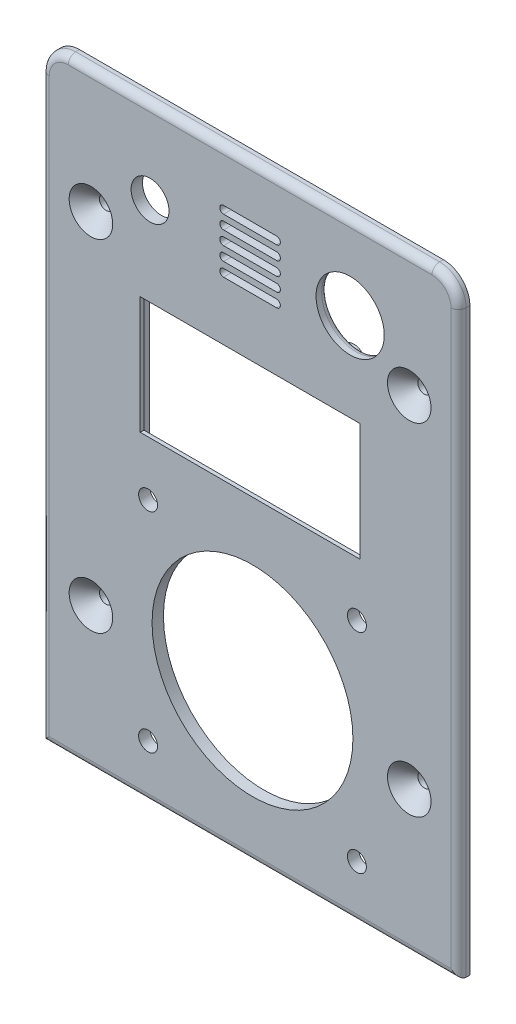
from build123d import *

# Parameters (mm, degrees)
BOSS_EXTRUDE1_DEPTH     = 3
FILLET1_R               = 2
SKETCH3_W               = 96
SKETCH3_H               = 152.5
BOSS_EXTRUDE2_DEPTH     = 3.9
CUT_EXTRUDE1_REACH      = 196.287
SKETCH4_R               = 1.75
CHAMFER1_SIZE           = 4
SKETCH5_R               = 5
SKETCH5_R_2             = 9
CUT_EXTRUDE2_DEPTH      = 195.204042265
FILLET2_R               = 1.5
SKETCH7_W               = 20
SKETCH7_H               = 20
SKETCH7_W_2             = 18
SKETCH7_H_2             = 18
BOSS_EXTRUDE3_DEPTH     = 3.9
CUT_EXTRUDE3_DEPTH      = 195.204042265
CROQUIS1_R              = 3
CROQUIS1_R_2            = 1.25
SALIENTE_EXTRUIR1_DEPTH = 5
CROQUIS2_R              = 3
CROQUIS2_R_2            = 1.25
CROQUIS2_W              = 22
CROQUIS2_H              = 3
SALIENTE_EXTRUIR2_DEPTH = 5.5
CORTAR_EXTRUIR1_REACH   = 196.243
CROQUIS3_R              = 26.5
CORTAR_EXTRUIR2_REACH   = 196.243
CROQUIS4_R              = 2.5
CROQUIS5_W              = 59
CROQUIS5_H              = 40
CORTAR_EXTRUIR3_DEPTH   = 2
CROQUIS6_W              = 58
CROQUIS6_H              = 31
CORTAR_EXTRUIR4_DEPTH   = 2


with BuildPart() as part:
    # Sketch1 → Boss-Extrude1 (new body)
    with BuildSketch(Plane.XY):
        with BuildLine():
            Line((0, 0), (110, 0))
            Line((110, 0), (110, 153))
            ThreePointArc((110, 153), (107.949747468, 157.949747468), (103, 160))
            Line((103, 160), (7, 160))
            ThreePointArc((7, 160), (2.050252532, 157.949747468), (0, 153))
            Line((0, 153), (0, 0))
        make_face()
    extrude(amount=BOSS_EXTRUDE1_DEPTH)

    # Fillet1
    fillet1_edges = [part.edges().sort_by_distance(p)[0] for p in [
        (110, 76.5, 3),
        (107.949747468, 157.949747468, 3),
        (55, 160, 3),
        (2.050252532, 157.949747468, 3),
        (0, 76.5, 3),
        (55, 0, 3),
    ]]
    fillet(fillet1_edges, radius=FILLET1_R)

    # Sketch3 → Boss-Extrude2 (add)
    with BuildSketch(Plane(origin=(0, 0, 0), x_dir=(-1, 0, 0), z_dir=(0, 0, -1))):
        with Locations((-55, 76.25)):
            Rectangle(SKETCH3_W, SKETCH3_H)
        with BuildLine():
            Line((-101.4, 1.6), (-101.4, 33.5))
            Line((-101.4, 33.5), (-97, 33.5))
            ThreePointArc((-97, 33.5), (-93, 37.5), (-97, 41.5))
            Line((-97, 41.5), (-101.4, 41.5))
            Line((-101.4, 41.5), (-101.4, 123.5))
            Line((-101.4, 123.5), (-97, 123.5))
            ThreePointArc((-97, 123.5), (-93, 127.5), (-97, 131.5))
            Line((-97, 131.5), (-101.4, 131.5))
            Line((-101.4, 131.5), (-101.4, 150.9))
            Line((-101.4, 150.9), (-8.6, 150.9))
            Line((-8.6, 150.9), (-8.6, 131.5))
            Line((-8.6, 131.5), (-13, 131.5))
            ThreePointArc((-13, 131.5), (-17, 127.5), (-13, 123.5))
            Line((-13, 123.5), (-8.6, 123.5))
            Line((-8.6, 123.5), (-8.6, 41.5))
            Line((-8.6, 41.5), (-13, 41.5))
            ThreePointArc((-13, 41.5), (-17, 37.5), (-13, 33.5))
            Line((-13, 33.5), (-8.6, 33.5))
            Line((-8.6, 33.5), (-8.6, 1.6))
            Line((-8.6, 1.6), (-101.4, 1.6))
        make_face(mode=Mode.SUBTRACT)
    extrude(amount=BOSS_EXTRUDE2_DEPTH)

    # Sketch4 → Cut-Extrude1 (cut, up to next)
    with BuildSketch(Plane(origin=(0, 0, -3.9), x_dir=(-1, 0, 0), z_dir=(0, 0, -1)), mode=Mode.PRIVATE) as cut_extrude1_sk1:
        with Locations((-97, 127.5)):
            Circle(SKETCH4_R)
    cut_extrude1_tool1 = extrude(cut_extrude1_sk1.sketch, amount=-CUT_EXTRUDE1_REACH, mode=Mode.PRIVATE) & part.part
    # Sketch4 → Cut-Extrude1 (cut, up to next)
    with BuildSketch(Plane(origin=(0, 0, -3.9), x_dir=(-1, 0, 0), z_dir=(0, 0, -1)), mode=Mode.PRIVATE) as cut_extrude1_sk2:
        with Locations((-13, 127.5)):
            Circle(SKETCH4_R)
    cut_extrude1_tool2 = extrude(cut_extrude1_sk2.sketch, amount=-CUT_EXTRUDE1_REACH, mode=Mode.PRIVATE) & part.part
    # Sketch4 → Cut-Extrude1 (cut, up to next)
    with BuildSketch(Plane(origin=(0, 0, -3.9), x_dir=(-1, 0, 0), z_dir=(0, 0, -1)), mode=Mode.PRIVATE) as cut_extrude1_sk3:
        with Locations((-13, 37.5)):
            Circle(SKETCH4_R)
    cut_extrude1_tool3 = extrude(cut_extrude1_sk3.sketch, amount=-CUT_EXTRUDE1_REACH, mode=Mode.PRIVATE) & part.part
    # Sketch4 → Cut-Extrude1 (cut, up to next)
    with BuildSketch(Plane(origin=(0, 0, -3.9), x_dir=(-1, 0, 0), z_dir=(0, 0, -1)), mode=Mode.PRIVATE) as cut_extrude1_sk4:
        with Locations((-97, 37.5)):
            Circle(SKETCH4_R)
    cut_extrude1_tool4 = extrude(cut_extrude1_sk4.sketch, amount=-CUT_EXTRUDE1_REACH, mode=Mode.PRIVATE) & part.part
    add(cut_extrude1_tool1.solids().sort_by_distance((97, 127.5, -3.9))[0], mode=Mode.SUBTRACT)
    add(cut_extrude1_tool2.solids().sort_by_distance((13, 127.5, -3.9))[0], mode=Mode.SUBTRACT)
    add(cut_extrude1_tool3.solids().sort_by_distance((13, 37.5, -3.9))[0], mode=Mode.SUBTRACT)
    add(cut_extrude1_tool4.solids().sort_by_distance((97, 37.5, -3.9))[0], mode=Mode.SUBTRACT)

    # Chamfer1
    chamfer1_edges = [part.edges().sort_by_distance(p)[0] for p in [
        (98.75, 37.5, 3),
        (14.75, 37.5, 3),
        (14.75, 127.5, 3),
        (98.75, 127.5, 3),
    ]]
    chamfer(chamfer1_edges, length=CHAMFER1_SIZE)

    # Sketch5 → Cut-Extrude2 (cut, through all)
    with BuildSketch(Plane(origin=(0, 0, 0), x_dir=(-1, 0, 0), z_dir=(0, 0, -1))):
        with Locations((-28.6, 137.9)):
            Circle(SKETCH5_R)
        with Locations((-81.4, 137.9)):
            Circle(SKETCH5_R_2)
    extrude(amount=-CUT_EXTRUDE2_DEPTH, mode=Mode.SUBTRACT)

    # Fillet2
    fillet2_edges = [part.edges().sort_by_distance(p)[0] for p in [
        (90.4, 137.9, 0),
    ]]
    fillet(fillet2_edges, radius=FILLET2_R)

    # Sketch7 → Boss-Extrude3 (add)
    with BuildSketch(Plane(origin=(0, 0, 0), x_dir=(-1, 0, 0), z_dir=(0, 0, -1))):
        with Locations((-55, 137.9)):
            Rectangle(SKETCH7_W, SKETCH7_H)
        with Locations((-55, 137.9)):
            Rectangle(SKETCH7_W_2, SKETCH7_H_2, mode=Mode.SUBTRACT)
    extrude(amount=BOSS_EXTRUDE3_DEPTH)

    # Sketch8 → Cut-Extrude3 (cut, through all)
    with BuildSketch(Plane(origin=(0, 0, 0), x_dir=(-1, 0, 0), z_dir=(0, 0, -1))):
        with BuildLine():
            Line((-62, 146.4), (-48, 146.4))
            ThreePointArc((-48, 146.4), (-47, 145.4), (-48, 144.4))
            Line((-48, 144.4), (-62, 144.4))
            ThreePointArc((-62, 144.4), (-63, 145.4), (-62, 146.4))
        make_face()
        with BuildLine():
            Line((-62, 142.8), (-48, 142.8))
            ThreePointArc((-48, 142.8), (-47, 141.8), (-48, 140.8))
            Line((-48, 140.8), (-62, 140.8))
            ThreePointArc((-62, 140.8), (-63, 141.8), (-62, 142.8))
        make_face()
        with BuildLine():
            Line((-62, 139.2), (-48, 139.2))
            ThreePointArc((-48, 139.2), (-47, 138.2), (-48, 137.2))
            Line((-48, 137.2), (-62, 137.2))
            ThreePointArc((-62, 137.2), (-63, 138.2), (-62, 139.2))
        make_face()
        with BuildLine():
            Line((-62, 135.6), (-48, 135.6))
            ThreePointArc((-48, 135.6), (-47, 134.6), (-48, 133.6))
            Line((-48, 133.6), (-62, 133.6))
            ThreePointArc((-62, 133.6), (-63, 134.6), (-62, 135.6))
        make_face()
        with BuildLine():
            Line((-62, 132), (-48, 132))
            ThreePointArc((-48, 132), (-47, 131), (-48, 130))
            Line((-48, 130), (-62, 130))
            ThreePointArc((-62, 130), (-63, 131), (-62, 132))
        make_face()
    extrude(amount=-CUT_EXTRUDE3_DEPTH, mode=Mode.SUBTRACT)

    # Croquis1 → Saliente-Extruir1 (add)
    with BuildSketch(Plane(origin=(0, 0, 0), x_dir=(-1, 0, 0), z_dir=(0, 0, -1))):
        with Locations((-28.6, 116.15)):
            Circle(CROQUIS1_R)
        with Locations((-28.6, 116.15)):
            Circle(CROQUIS1_R_2, mode=Mode.SUBTRACT)
    extrude(amount=SALIENTE_EXTRUIR1_DEPTH)

    # Croquis2 → Saliente-Extruir2 (add)
    # profile 1 of 3: a face of its own
    with BuildSketch(Plane(origin=(0, 0, 0), x_dir=(-1, 0, 0), z_dir=(0, 0, -1))):
        with Locations((-88.9, 120.4)):
            Circle(CROQUIS2_R)
        with Locations((-88.9, 120.4)):
            Circle(CROQUIS2_R_2, mode=Mode.SUBTRACT)
    # profile 2 of 3: a face of its own
    with BuildSketch(Plane(origin=(0, 0, 0), x_dir=(-1, 0, 0), z_dir=(0, 0, -1))):
        with Locations((-73.9, 120.4)):
            Circle(CROQUIS2_R)
        with Locations((-73.9, 120.4)):
            Circle(CROQUIS2_R_2, mode=Mode.SUBTRACT)
    # profile 3 of 3: a face of its own
    with BuildSketch(Plane(origin=(0, 0, 0), x_dir=(-1, 0, 0), z_dir=(0, 0, -1))):
        with Locations((-81.4, 149.4)):
            Rectangle(CROQUIS2_W, CROQUIS2_H)
    extrude(amount=SALIENTE_EXTRUIR2_DEPTH)

    # Croquis3 → Cortar-Extruir1 (cut, up to next)
    with BuildSketch(Plane(origin=(0, 0, 0), x_dir=(-1, 0, 0), z_dir=(0, 0, -1)), mode=Mode.PRIVATE) as cortar_extruir1_sk1:
        with Locations((-55.631510191, 41.6)):
            Circle(CROQUIS3_R)
    cortar_extruir1_tool1 = extrude(cortar_extruir1_sk1.sketch, amount=-CORTAR_EXTRUIR1_REACH, mode=Mode.PRIVATE) & part.part
    add(cortar_extruir1_tool1.solids().sort_by_distance((55.63151, 41.6, 0))[0], mode=Mode.SUBTRACT)

    # Croquis4 → Cortar-Extruir2 (cut, up to next)
    with BuildSketch(Plane(origin=(0, 0, 0), x_dir=(-1, 0, 0), z_dir=(0, 0, -1)), mode=Mode.PRIVATE) as cortar_extruir2_sk1:
        with Locations((-83.181762723, 69.150252532)):
            Circle(CROQUIS4_R)
    cortar_extruir2_tool1 = extrude(cortar_extruir2_sk1.sketch, amount=-CORTAR_EXTRUIR2_REACH, mode=Mode.PRIVATE) & part.part
    # Croquis4 → Cortar-Extruir2 (cut, up to next)
    with BuildSketch(Plane(origin=(0, 0, 0), x_dir=(-1, 0, 0), z_dir=(0, 0, -1)), mode=Mode.PRIVATE) as cortar_extruir2_sk2:
        with Locations((-28.081257659, 69.150252532)):
            Circle(CROQUIS4_R)
    cortar_extruir2_tool2 = extrude(cortar_extruir2_sk2.sketch, amount=-CORTAR_EXTRUIR2_REACH, mode=Mode.PRIVATE) & part.part
    # Croquis4 → Cortar-Extruir2 (cut, up to next)
    with BuildSketch(Plane(origin=(0, 0, 0), x_dir=(-1, 0, 0), z_dir=(0, 0, -1)), mode=Mode.PRIVATE) as cortar_extruir2_sk3:
        with Locations((-28.081257659, 14.049747468)):
            Circle(CROQUIS4_R)
    cortar_extruir2_tool3 = extrude(cortar_extruir2_sk3.sketch, amount=-CORTAR_EXTRUIR2_REACH, mode=Mode.PRIVATE) & part.part
    # Croquis4 → Cortar-Extruir2 (cut, up to next)
    with BuildSketch(Plane(origin=(0, 0, 0), x_dir=(-1, 0, 0), z_dir=(0, 0, -1)), mode=Mode.PRIVATE) as cortar_extruir2_sk4:
        with Locations((-83.181762723, 14.049747468)):
            Circle(CROQUIS4_R)
    cortar_extruir2_tool4 = extrude(cortar_extruir2_sk4.sketch, amount=-CORTAR_EXTRUIR2_REACH, mode=Mode.PRIVATE) & part.part
    add(cortar_extruir2_tool1.solids().sort_by_distance((83.181763, 69.150253, 0))[0], mode=Mode.SUBTRACT)
    add(cortar_extruir2_tool2.solids().sort_by_distance((28.081258, 69.150253, 0))[0], mode=Mode.SUBTRACT)
    add(cortar_extruir2_tool3.solids().sort_by_distance((28.081258, 14.049747, 0))[0], mode=Mode.SUBTRACT)
    add(cortar_extruir2_tool4.solids().sort_by_distance((83.181763, 14.049747, 0))[0], mode=Mode.SUBTRACT)

    # Croquis5 → Cortar-Extruir3 (cut)
    with BuildSketch(Plane(origin=(0, 0, 0), x_dir=(-1, 0, 0), z_dir=(0, 0, -1))):
        with Locations((-55, 95.542989332)):
            Rectangle(CROQUIS5_W, CROQUIS5_H)
    extrude(amount=-CORTAR_EXTRUIR3_DEPTH, mode=Mode.SUBTRACT)

    # Croquis6 → Cortar-Extruir4 (cut)
    with BuildSketch(Plane(origin=(0, 0, 2), x_dir=(-1, 0, 0), z_dir=(0, 0, -1))):
        with Locations((-55, 99.042989332)):
            Rectangle(CROQUIS6_W, CROQUIS6_H)
    extrude(amount=-CORTAR_EXTRUIR4_DEPTH, mode=Mode.SUBTRACT)


solid = part.part
